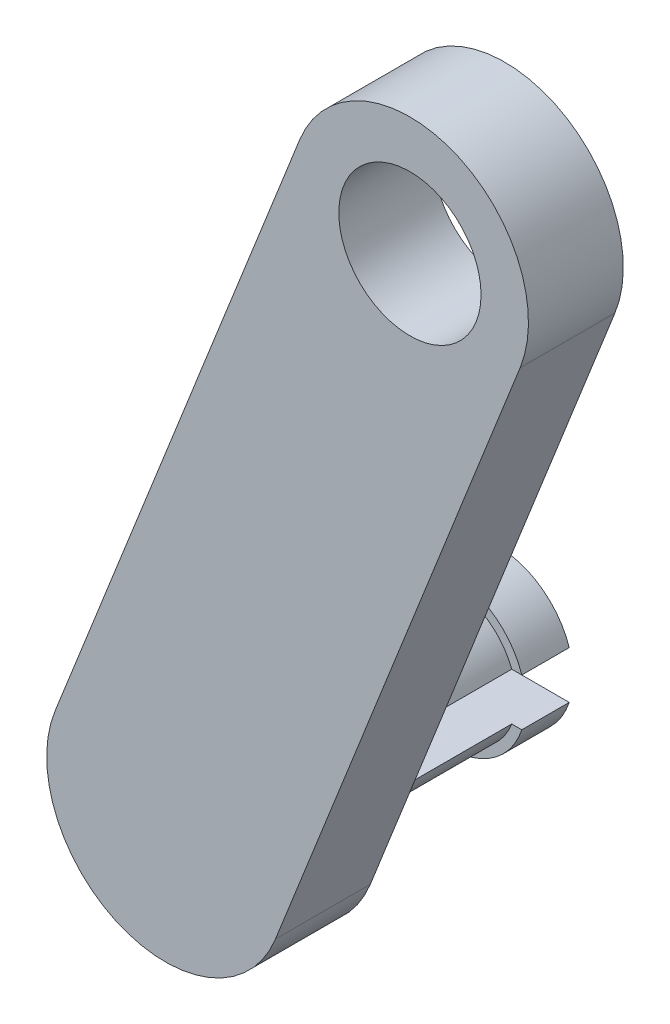
from build123d import *

# Parameters (mm, degrees)
BOSS_EXTRU_1_DEPTH      = 2
ESQUISSE2_R             = 1.5
ENL_V_MAT_EXTRU_1_DEPTH = 3
ESQUISSE3_R             = 1.4
BOSS_EXTRU_2_DEPTH      = 4
ESQUISSE4_R             = 1.6
BOSS_EXTRU_3_DEPTH      = 1
ESQUISSE5_W             = 4
ESQUISSE5_H             = 1
ENL_V_MAT_EXTRU_2_DEPTH = 5


with BuildPart() as part:
    # Esquisse1 → Boss.-Extru.1 (new body)
    with BuildSketch(Plane.XY):
        with BuildLine():
            Line((-13.675991632, -1.921403878), (-18.835853347, -14.935850738))
            ThreePointArc((-18.835853347, -14.935850738), (-22.081265593, -16.338455228), (-23.483870083, -13.093042983))
            Line((-23.483870083, -13.093042983), (-18.324008368, -0.078596122))
            ThreePointArc((-18.324008368, -0.078596122), (-15.078596122, 1.324008368), (-13.675991632, -1.921403878))
        make_face()
    extrude(amount=BOSS_EXTRU_1_DEPTH)

    # Esquisse2 → Enlèv. mat.-Extru.1 (cut)
    with BuildSketch(Plane.XY.offset(2)):
        with Locations((-16, -1)):
            Circle(ESQUISSE2_R)
    extrude(amount=-ENL_V_MAT_EXTRU_1_DEPTH, mode=Mode.SUBTRACT)

    # Esquisse3 → Boss.-Extru.2 (add)
    with BuildSketch(Plane(origin=(0, 0, 0), x_dir=(-1, 0, 0), z_dir=(0, 0, -1))):
        with Locations(Location((21.159861715, -14.01444686, 0), (0, 0, 180))):
            Circle(ESQUISSE3_R)
    extrude(amount=BOSS_EXTRU_2_DEPTH)

    # Esquisse4 → Boss.-Extru.3 (add)
    with BuildSketch(Plane(origin=(0, 0, -4), x_dir=(-1, 0, 0), z_dir=(0, 0, -1))):
        with Locations((21.159861715, -14.01444686)):
            Circle(ESQUISSE4_R)
    extrude(amount=BOSS_EXTRU_3_DEPTH)

    # Esquisse5 → Enlèv. mat.-Extru.2 (cut)
    with BuildSketch(Plane(origin=(0, 0, -5), x_dir=(-1, 0, 0), z_dir=(0, 0, -1))):
        with Locations((21.159861715, -14.01444686)):
            Rectangle(ESQUISSE5_W, ESQUISSE5_H)
    extrude(amount=-ENL_V_MAT_EXTRU_2_DEPTH, mode=Mode.SUBTRACT)


solid = part.part
